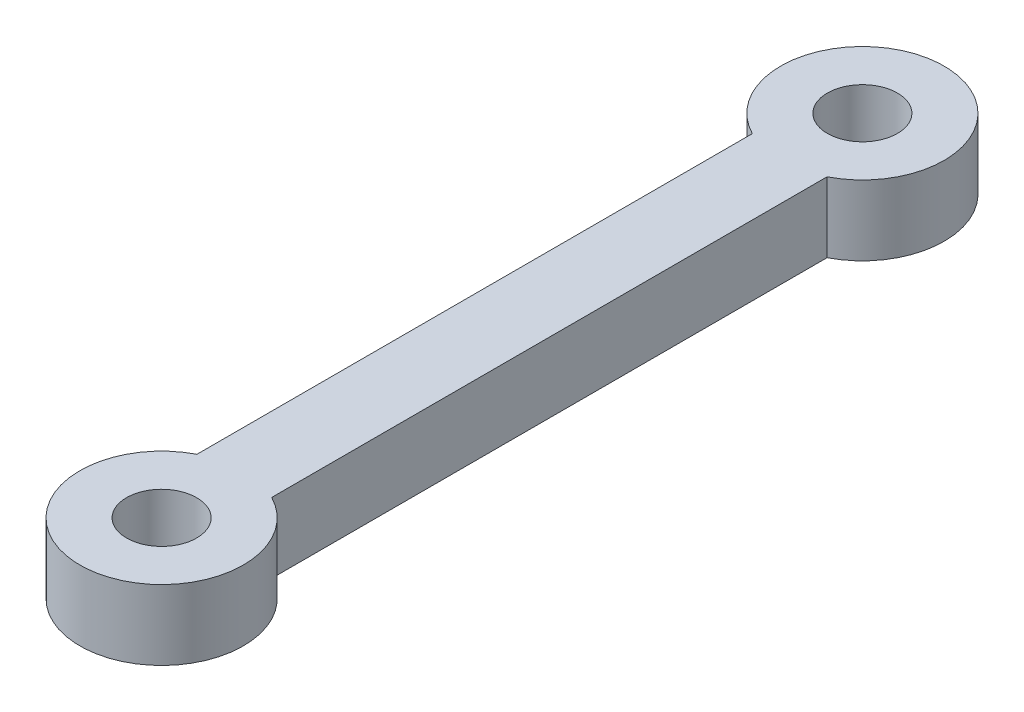
from build123d import *

# Parameters (mm, degrees)
SKETCH1_R           = 1.5
BOSS_EXTRUDE1_DEPTH = 3


with BuildPart() as part:
    # Sketch1 → Boss-Extrude1 (new body)
    with BuildSketch(Plane(origin=(0, 0, 0), x_dir=(1, 0, 0), z_dir=(0, 1, 0))):
        with BuildLine():
            Line((-1.6, 3.112876483), (-1.6, 26.887123517))
            ThreePointArc((-1.6, 26.887123517), (0, 33.5), (1.6, 26.887123517))
            Line((1.6, 26.887123517), (1.6, 3.112876483))
            ThreePointArc((1.6, 3.112876483), (0, -3.5), (-1.6, 3.112876483))
        make_face()
        with Locations(Location((0, 0, 0), (0, 0, 270))):
            Circle(SKETCH1_R, mode=Mode.SUBTRACT)
        with Locations(Location((0, 30, 0), (0, 0, 270))):
            Circle(SKETCH1_R, mode=Mode.SUBTRACT)
    extrude(amount=BOSS_EXTRUDE1_DEPTH)


solid = part.part
